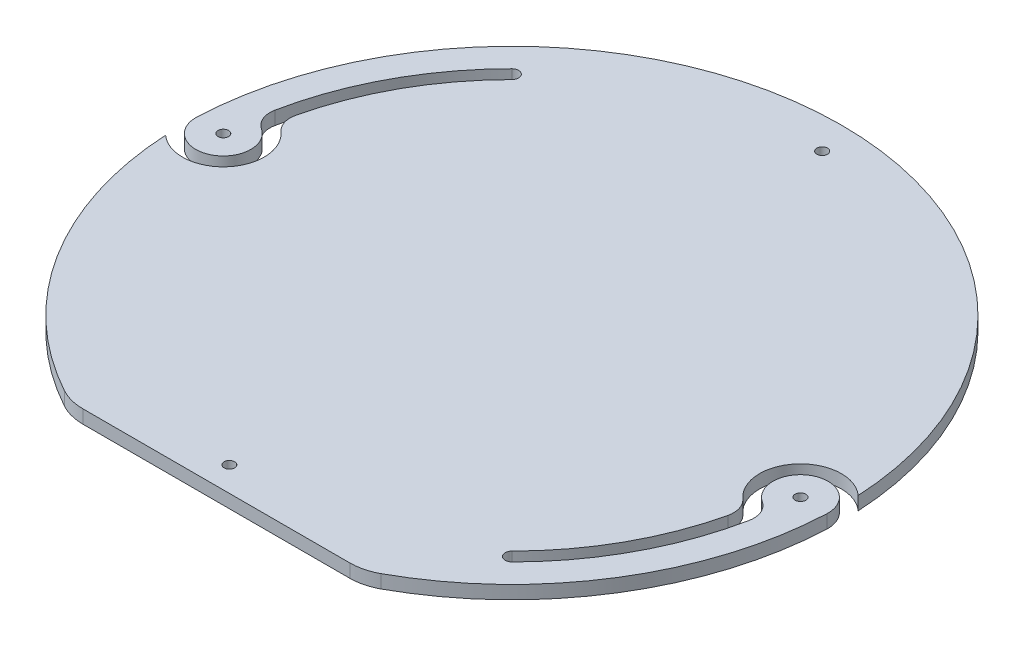
from build123d import *

# Parameters (mm, degrees)
BOSS_EXTRUDE1_DEPTH = 3
SKETCH2_R           = 1.2
CUT_EXTRUDE1_DEPTH  = 105.977521403
CUT_EXTRUDE2_DEPTH  = 105.977521403


with BuildPart() as part:
    # Sketch1 → Boss-Extrude1 (new body)
    with BuildSketch(Plane(origin=(0, 0, 0), x_dir=(1, 0, 0), z_dir=(0, 1, 0))):
        with BuildLine():
            Line((-30.029977361, -66.512867647), (30.029977361, -66.512867647))
            ThreePointArc((30.029977361, -66.512867647), (32.931413623, -66.147401939), (35.651589123, -65.073836471))
            ThreePointArc((35.651589123, -65.073836471), (0, 74.2), (-35.651589123, -65.073836471))
            ThreePointArc((-35.651589123, -65.073836471), (-32.931413623, -66.147401939), (-30.029977361, -66.512867647))
        make_face()
    extrude(amount=BOSS_EXTRUDE1_DEPTH)

    # Sketch2 → Cut-Extrude1 (cut, through all)
    with BuildSketch(Plane(origin=(0, 3, 0), x_dir=(1, 0, 0), z_dir=(0, 1, 0))):
        with Locations(Location((-2.660782629, -60.941941516, 0), (0, 0, 270))):
            Circle(SKETCH2_R)
        with Locations(Location((-67.935279068, 2.966118341, 0), (0, 0, 270))):
            Circle(SKETCH2_R)
        with Locations(Location((2.922498953, 66.936230846, 0), (0, 0, 270))):
            Circle(SKETCH2_R)
        with Locations(Location((67.935279068, -2.966118341, 0), (0, 0, 270))):
            Circle(SKETCH2_R)
    extrude(amount=-CUT_EXTRUDE1_DEPTH, mode=Mode.SUBTRACT)

    # Sketch3 → Cut-Extrude2 (cut, through all)
    with BuildSketch(Plane(origin=(0, 3, 0), x_dir=(1, 0, 0), z_dir=(0, 1, 0))):
        with BuildLine():
            ThreePointArc((-74.129378041, 3.236558543), (-65.111947644, -2.5537367), (-64.529371908, 8.146832232))
            ThreePointArc((-64.529371908, 8.146832232), (-66.395420161, 10.395433666), (-66.686059299, 13.302988203))
            ThreePointArc((-66.686059299, 13.302988203), (-59.961788445, 32.071543875), (-48.083261121, 48.083261121))
            ThreePointArc((-48.083261121, 48.083261121), (-45.961940777, 48.083261121), (-45.961940777, 45.961940777))
            ThreePointArc((-45.961940777, 45.961940777), (-56.839700689, 31.531705085), (-63.324224445, 14.664330822))
            ThreePointArc((-63.324224445, 14.664330822), (-63.220830412, 12.029973663), (-61.791915049, 9.814408532))
            ThreePointArc((-61.791915049, 9.814408532), (-61.096295148, -3.187604024), (-74.099345682, -3.86354364))
            ThreePointArc((-74.099345682, -3.86354364), (-74.19933623, -0.313851977), (-74.129378041, 3.236558543))
        make_face()
        with BuildLine():
            ThreePointArc((74.129378041, -3.236558543), (65.111947644, 2.5537367), (64.529371908, -8.146832232))
            ThreePointArc((64.529371908, -8.146832232), (66.395420161, -10.395433666), (66.686059299, -13.302988203))
            ThreePointArc((66.686059299, -13.302988203), (59.961788445, -32.071543875), (48.083261121, -48.083261121))
            ThreePointArc((48.083261121, -48.083261121), (45.961940777, -48.083261121), (45.961940777, -45.961940777))
            ThreePointArc((45.961940777, -45.961940777), (56.839700689, -31.531705085), (63.324224445, -14.664330822))
            ThreePointArc((63.324224445, -14.664330822), (63.220830412, -12.029973663), (61.791915049, -9.814408532))
            ThreePointArc((61.791915049, -9.814408532), (61.096295148, 3.187604024), (74.099345682, 3.86354364))
            ThreePointArc((74.099345682, 3.86354364), (74.19933623, 0.313851977), (74.129378041, -3.236558543))
        make_face()
    extrude(amount=-CUT_EXTRUDE2_DEPTH, mode=Mode.SUBTRACT)


solid = part.part
